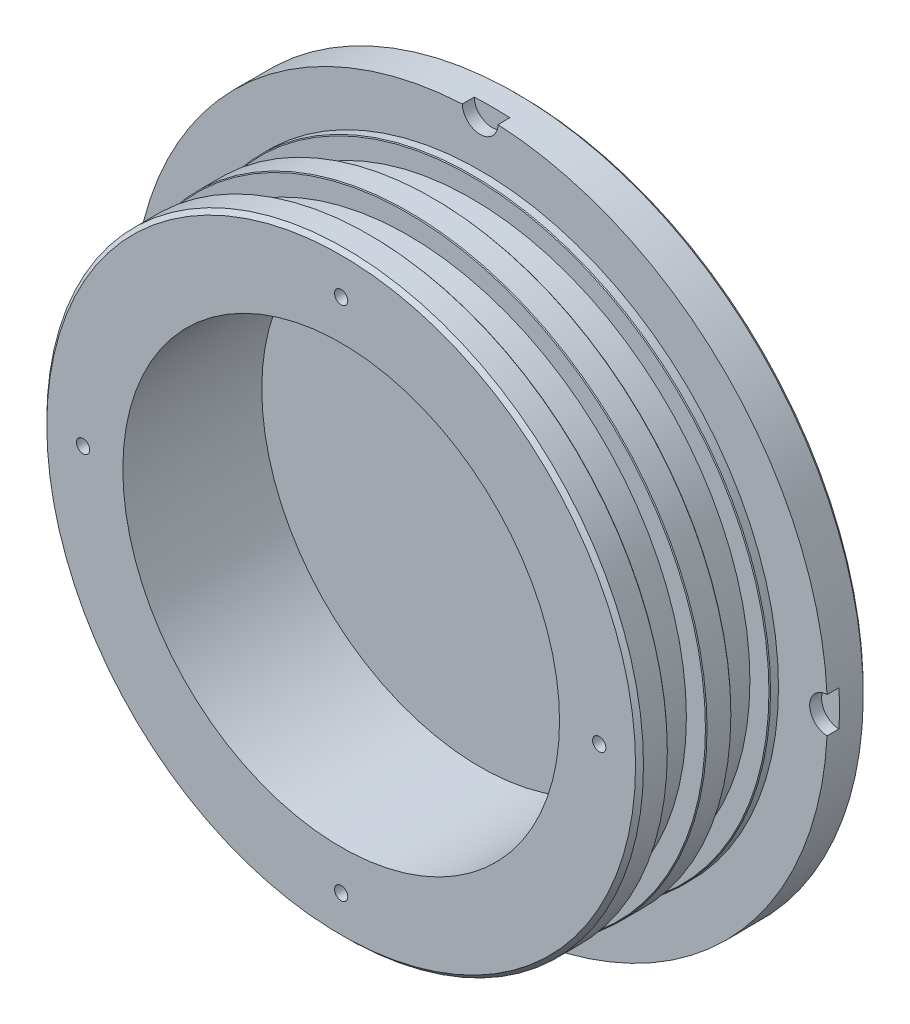
from build123d import *

# Parameters (mm, degrees)
DIAM_TRE_DU_PER_AGE_9_0_9_1_D     = 9
DIAM_TRE_DU_PER_AGE_9_0_9_1_DEPTH = 3
D_GAGEMENT_M31_D                  = 3.332
D_GAGEMENT_M31_DEPTH              = 16
D_GAGEMENT_M31_TIP                = 1.001033791
D_GAGEMENT_M1001_D                = 110
D_GAGEMENT_M1001_DEPTH            = 35
CHANFREIN1_SIZE                   = 0.2
CHANFREIN2_SIZE                   = 1


with BuildPart() as part:
    # Esquisse1 → Révolution1 (revolve)
    with BuildSketch(Plane(origin=(0, 0, 0), x_dir=(1, 0, 0), z_dir=(0, 1, 0))):
        Polygon((87.5, 159.225), (0, 159.225), (0, 114.225), (75.15, 114.225), (75.15, 121.425), (70.15, 121.425), (70.15, 131.025), (75.15, 131.025), (75.15, 137.425), (70.15, 137.425), (70.15, 147.025), (75.15, 147.025), (75.15, 149.225), (87.5, 149.225), align=None)
    revolve(axis=Axis((0, 0, -159.225), (0, 0, 1)))

    # Diamètre du perçage Ø9.0 (9)1
    with Locations(Plane.XY.offset(-149.225)):
        with Locations((-87.5, 0), (0, 87.5), (0, -87.5), (87.5, 0)):
            Hole(DIAM_TRE_DU_PER_AGE_9_0_9_1_D / 2, depth=DIAM_TRE_DU_PER_AGE_9_0_9_1_DEPTH)

    # Dégagement M31
    with Locations(Plane.XY.offset(-114.225)):
        with Locations((-65, 0), (65, 0), (0, 65), (0, -65)):
            Hole(D_GAGEMENT_M31_D / 2, depth=D_GAGEMENT_M31_DEPTH)
            with Locations((0, 0, -(D_GAGEMENT_M31_DEPTH + D_GAGEMENT_M31_TIP / 2))):  # 118° drill point
                Cone(0, D_GAGEMENT_M31_D / 2, D_GAGEMENT_M31_TIP, mode=Mode.SUBTRACT)

    # Dégagement M1001
    with Locations(Plane.XY.offset(-114.225)):
        with Locations((0, 0)):
            Hole(D_GAGEMENT_M1001_D / 2, depth=D_GAGEMENT_M1001_DEPTH)

    # Chanfrein1
    chanfrein1_edges = [part.edges().sort_by_distance(p)[0] for p in [
        (-75.15, 0, -147.025),
        (-75.15, 0, -137.425),
        (-75.15, 0, -131.025),
        (-75.15, 0, -121.425),
    ]]
    chamfer(chanfrein1_edges, length=CHANFREIN1_SIZE)

    # Chanfrein2
    chanfrein2_edges = [part.edges().sort_by_distance(p)[0] for p in [
        (-75.15, 0, -114.225),
        (-87.5, 0, -159.225),
    ]]
    chamfer(chanfrein2_edges, length=CHANFREIN2_SIZE)


solid = part.part
